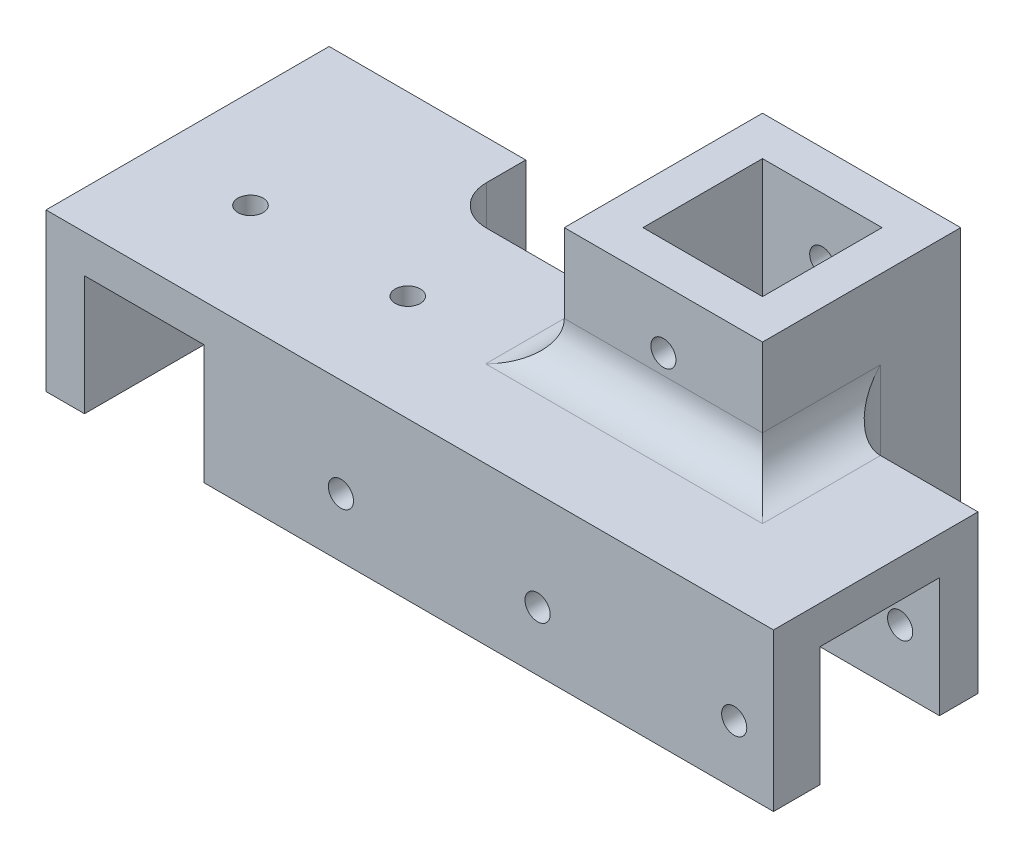
from build123d import *

# Parameters (mm, degrees)
SKETCH_1_W               = 15.2
SKETCH_1_H               = 15.2
EXTRUDE_1_DEPTH          = 20
SKETCH_2_W               = 25.2
SKETCH_2_H               = 25.2
SKETCH_2_W_2             = 15.2
SKETCH_2_H_2             = 15.2
EXTRUDE_2_DEPTH          = 15
SKETCH_3_W               = 15.2
SKETCH_3_H               = 15.2
CUT_EXTRUDE_1_DEPTH      = 80
SKETCH_4_R               = 1.6
CUT_EXTRUDE_2_DEPTH      = 83.635888087
FILLET_1_R               = 5
SKETCH_5_W               = 15.2
SKETCH_5_H               = 15.2
CUT_EXTRUDE_3_DEPTH      = 83.635888087
CUT_EXTRUDE_4_REACH      = 104.706
CUT_EXTRUDE_4_END_RADIUS = 5
SKETCH_6_R               = 1.6
CUT_EXTRUDE_5_REACH      = 73.229
SKETCH_7_R               = 1.6


with BuildPart() as part:
    # 草图1 → 凸台-拉伸1 (new body)
    with BuildSketch(Plane(origin=(0, 0, 0), x_dir=(1, 0, 0), z_dir=(0, 1, 0))):
        Polygon((-37.5, 12.5), (-12.6, 12.5), (-12.6, 27.7), (12.6, 27.7), (12.6, 12.5), (30, 12.5), (30, -13.5), (-62.5, -13.5), (-62.5, 22.5), (-37.5, 22.5), align=None)
        with Locations((0, 15.1)):
            Rectangle(SKETCH_1_W, SKETCH_1_H, mode=Mode.SUBTRACT)
    extrude(amount=EXTRUDE_1_DEPTH)

    # 草图2 → 凸台-拉伸2 (add)
    with BuildSketch(Plane(origin=(0, 20, 0), x_dir=(1, 0, 0), z_dir=(0, 1, 0))):
        with Locations((0, 15.1)):
            Rectangle(SKETCH_2_W, SKETCH_2_H)
        with Locations((0, 15.1)):
            Rectangle(SKETCH_2_W_2, SKETCH_2_H_2, mode=Mode.SUBTRACT)
    extrude(amount=EXTRUDE_2_DEPTH)

    # 草图3 → 切除-拉伸1 (cut)
    with BuildSketch(Plane(origin=(30, 0, 0), x_dir=(0, 0, -1), z_dir=(1, 0, 0))):
        with Locations((0, 7.6)):
            Rectangle(SKETCH_3_W, SKETCH_3_H)
    extrude(amount=-CUT_EXTRUDE_1_DEPTH, mode=Mode.SUBTRACT)

    # 草图4 → 切除-拉伸2 (cut, through all)
    with BuildSketch(Plane.XY.offset(13.5)):
        with Locations((0, 7.5)):
            Circle(SKETCH_4_R)
        with Locations((25, 7.5)):
            Circle(SKETCH_4_R)
        with Locations((-25, 7.5)):
            Circle(SKETCH_4_R)
        with Locations((0, 27.5)):
            Circle(SKETCH_4_R)
    extrude(amount=-CUT_EXTRUDE_2_DEPTH, mode=Mode.SUBTRACT)

    # 圆角1
    fillet_1_edges = [part.edges().sort_by_distance(p)[0] for p in [
        (-37.5, 10, -12.5),
        (-12.6, 10, -12.5),
        (12.6, 10, -12.5),
        (-12.6, 20, -7.5),
        (0, 20, -2.5),
        (12.6, 20, -7.5),
    ]]
    fillet(fillet_1_edges, radius=FILLET_1_R)

    # 草图5 → 切除-拉伸3 (cut, through all)
    with BuildSketch(Plane.XY.offset(13.5)):
        with Locations((-50, 7.6)):
            Rectangle(SKETCH_5_W, SKETCH_5_H)
    extrude(amount=-CUT_EXTRUDE_3_DEPTH, mode=Mode.SUBTRACT)

    # 切除-拉伸4: up to this cylinder (the profile starts outside it)
    cut_extrude_4_end = Plane(origin=(-32.5, 7.5, -17.5), z_dir=(0, 1, 0)) * Cylinder(CUT_EXTRUDE_4_END_RADIUS, 220.412, mode=Mode.PRIVATE)
    # 草图6 → 切除-拉伸4 (cut, up to the surface)
    with BuildSketch(Plane.ZY.offset(62.5), mode=Mode.PRIVATE) as cut_extrude_4_sk1:
        with Locations((-15, 7.5)):
            Circle(SKETCH_6_R)
    cut_extrude_4_tool1 = extrude(cut_extrude_4_sk1.sketch, amount=-CUT_EXTRUDE_4_REACH, mode=Mode.PRIVATE) - cut_extrude_4_end
    add(cut_extrude_4_tool1.solids().sort_by_distance((-62.5, 7.5, -15))[0], mode=Mode.SUBTRACT)

    # 草图7 → 切除-拉伸5 (cut, up to next)
    with BuildSketch(Plane(origin=(0, 20, 0), x_dir=(1, 0, 0), z_dir=(0, 1, 0)), mode=Mode.PRIVATE) as cut_extrude_5_sk1:
        with Locations(Location((-50, 0, 0), (0, 0, 270))):
            Circle(SKETCH_7_R)
    cut_extrude_5_tool1 = extrude(cut_extrude_5_sk1.sketch, amount=-CUT_EXTRUDE_5_REACH, mode=Mode.PRIVATE) & part.part
    # 草图7 → 切除-拉伸5 (cut, up to next)
    with BuildSketch(Plane(origin=(0, 20, 0), x_dir=(1, 0, 0), z_dir=(0, 1, 0)), mode=Mode.PRIVATE) as cut_extrude_5_sk2:
        with Locations(Location((-30, 0, 0), (0, 0, 270))):
            Circle(SKETCH_7_R)
    cut_extrude_5_tool2 = extrude(cut_extrude_5_sk2.sketch, amount=-CUT_EXTRUDE_5_REACH, mode=Mode.PRIVATE) & part.part
    add(cut_extrude_5_tool1.solids().sort_by_distance((-50, 20, 0))[0], mode=Mode.SUBTRACT)
    add(cut_extrude_5_tool2.solids().sort_by_distance((-30, 20, 0))[0], mode=Mode.SUBTRACT)


solid = part.part
